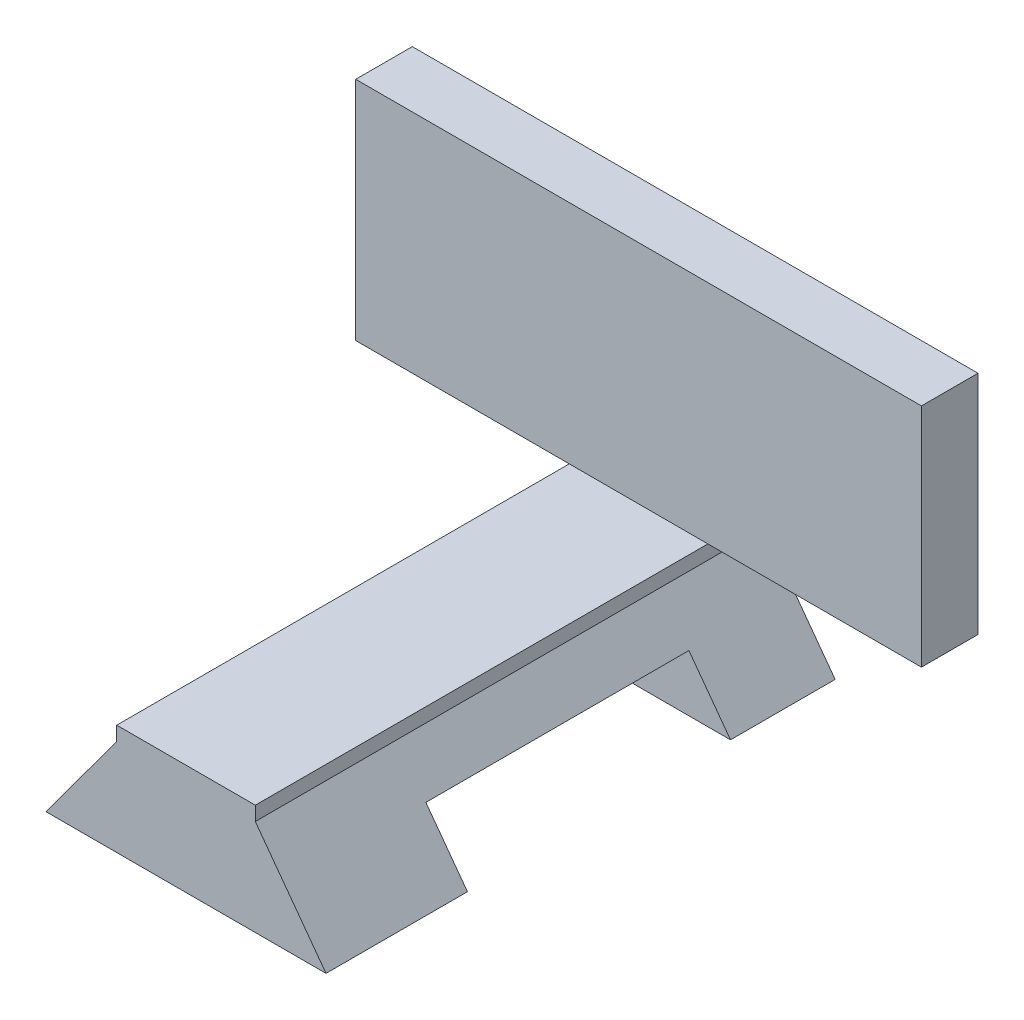
from build123d import *

# Parameters (mm, degrees)
BOSS_EXTRUDE1_DEPTH     = 18
SKETCH2_W               = 20
SKETCH2_H               = 8
BOSS_EXTRUDE2_DEPTH     = 2
CUT_EXTRUDE1_DEPTH      = 23.27666941
CUT_EXTRUDE1_DEPTH_BACK = 23.27666941
SKETCH3_W               = 9.3
SKETCH3_H               = 2
SKETCH4_R               = 1.4
BOSS_EXTRUDE3_DEPTH     = 2
FILLET1_R               = 0.5


with BuildPart() as part:
    # Sketch1 → Boss-Extrude1 (new body)
    with BuildSketch(Plane.XY):
        Polygon((-4.95, -3.4), (4.95, -3.4), (2.45, 0), (2.45, 0.5), (-2.45, 0.5), (-2.45, 0), align=None)
    extrude(amount=BOSS_EXTRUDE1_DEPTH)

    # Sketch2 → Boss-Extrude2 (add)
    with BuildSketch(Plane(origin=(0, 0, 0), x_dir=(-1, 0, 0), z_dir=(0, 0, -1))):
        with Locations((0, 4.5)):
            Rectangle(SKETCH2_W, SKETCH2_H)
    extrude(amount=-BOSS_EXTRUDE2_DEPTH)

    # Sketch3 → Cut-Extrude1 (cut, two sides: drawn at the far end of the back side and taken through both)
    with BuildSketch(Plane(origin=(0, 0, 0), x_dir=(0, 0, -1), z_dir=(1, 0, 0)).offset(-CUT_EXTRUDE1_DEPTH_BACK)):
        with Locations((-8.35, -2.4)):
            Rectangle(SKETCH3_W, SKETCH3_H)
    extrude(amount=CUT_EXTRUDE1_DEPTH + CUT_EXTRUDE1_DEPTH_BACK, mode=Mode.SUBTRACT)

    # Sketch4 → Boss-Extrude3 (add)
    with BuildSketch(Plane(origin=(0, 0, 0), x_dir=(-1, 0, 0), z_dir=(0, 0, -1))):
        with Locations((-6.2, 3)):
            Circle(SKETCH4_R)
        with Locations(Location((6.2, 3, 0), (0, 0, 180))):
            Circle(SKETCH4_R)
    extrude(amount=BOSS_EXTRUDE3_DEPTH)

    # Fillet1
    fillet1_edges = [part.edges().sort_by_distance(p)[0] for p in [
        (7.6, 3, -2),
        (-7.6, 3, -2),
    ]]
    fillet(fillet1_edges, radius=FILLET1_R)


solid = part.part
